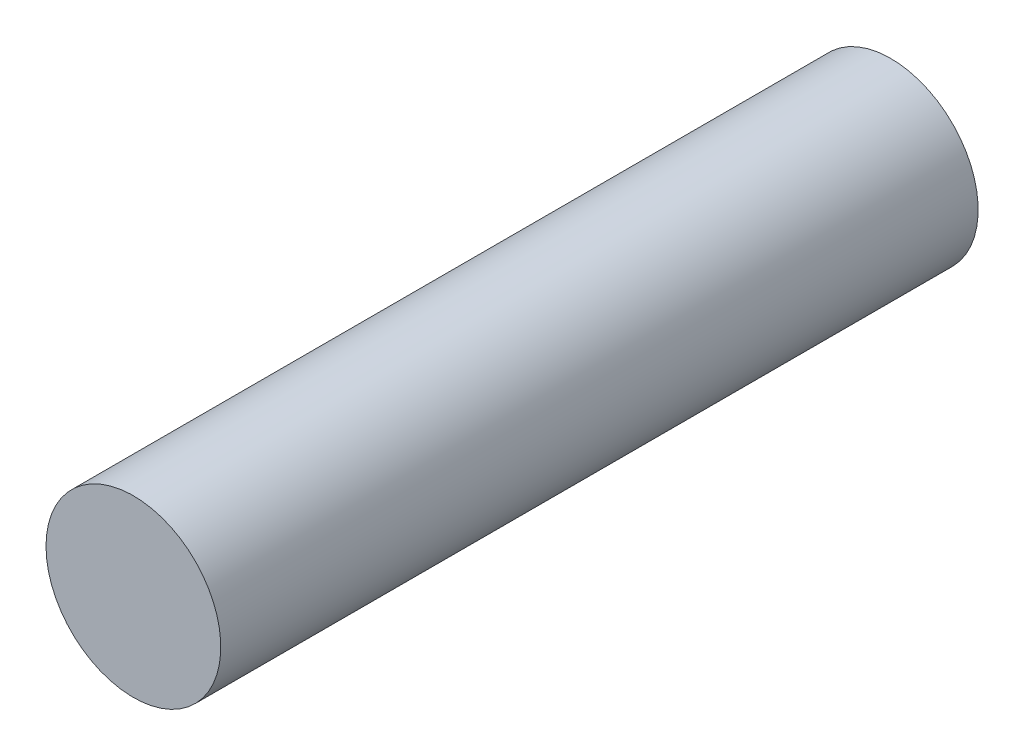
from build123d import *

# Parameters (mm, degrees)
SKETCH_1_R      = 1.5
EXTRUDE_1_DEPTH = 6.5


with BuildPart() as part:
    # 스케치1 → 보스-돌출1 (new, symmetric)
    with BuildSketch(Plane.XY):
        with Locations(Location((0, 0, 0), (0, 0, 180))):
            Circle(SKETCH_1_R)
    extrude(amount=EXTRUDE_1_DEPTH, both=True)


solid = part.part
